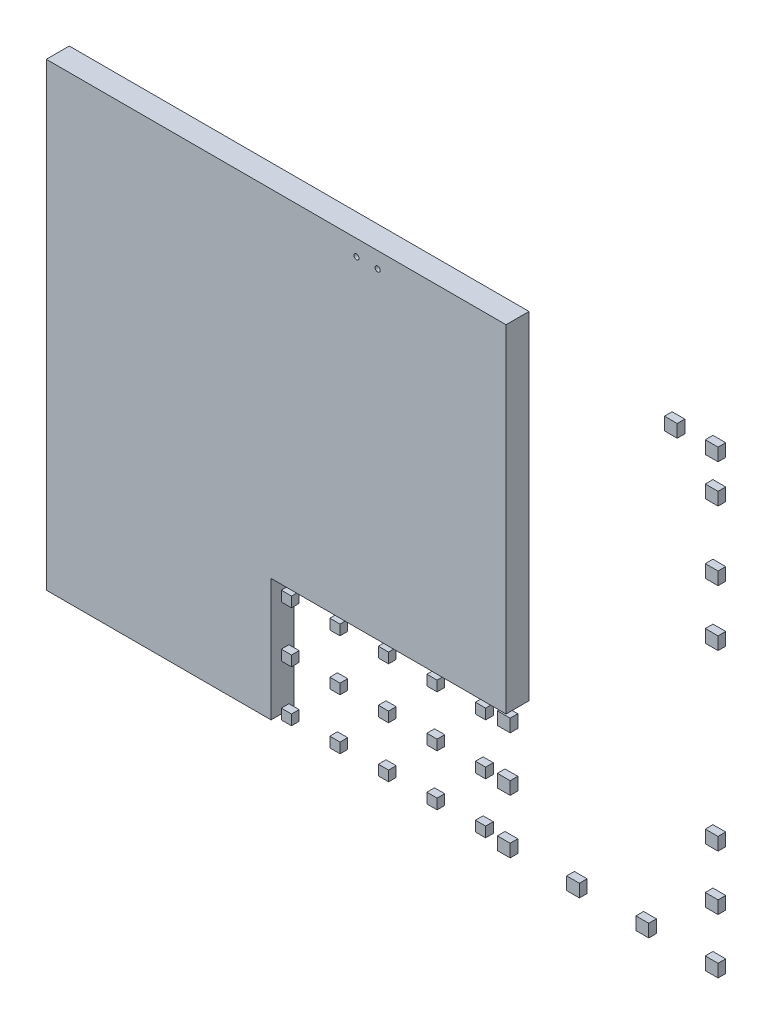
from build123d import *

# Parameters (mm, degrees)
SKETCH_1_R         = 50
EXTRUDE_1_DEPTH    = 150
SKETCH_1_W         = 250
SKETCH_1_H         = 250
EXTRUDE_1_2_DEPTH  = 150
EXTRUDE_1_3_DEPTH  = 150
EXTRUDE_1_4_DEPTH  = 150
EXTRUDE_1_5_DEPTH  = 150
EXTRUDE_1_6_DEPTH  = 150
EXTRUDE_1_7_DEPTH  = 150
EXTRUDE_1_8_DEPTH  = 150
EXTRUDE_1_9_DEPTH  = 150
EXTRUDE_1_10_DEPTH = 150
EXTRUDE_1_11_DEPTH = 150
EXTRUDE_1_12_DEPTH = 150
EXTRUDE_1_13_DEPTH = 150
EXTRUDE_1_14_DEPTH = 150
SKETCH_1_W_2       = 200
SKETCH_1_H_2       = 200
EXTRUDE_1_15_DEPTH = 150
EXTRUDE_1_16_DEPTH = 150
EXTRUDE_1_17_DEPTH = 150
EXTRUDE_1_18_DEPTH = 150
EXTRUDE_1_19_DEPTH = 150
EXTRUDE_1_20_DEPTH = 150
EXTRUDE_1_21_DEPTH = 150
EXTRUDE_1_22_DEPTH = 150
EXTRUDE_1_23_DEPTH = 150
EXTRUDE_1_24_DEPTH = 150
EXTRUDE_1_25_DEPTH = 150
EXTRUDE_1_26_DEPTH = 150
EXTRUDE_1_27_DEPTH = 150
EXTRUDE_1_28_DEPTH = 150
EXTRUDE_1_29_DEPTH = 150
EXTRUDE_2_DEPTH    = 300


with BuildPart() as part:
    # Эскиз1 → Бобышка-Вытянуть1 (new body)
    with BuildSketch(Plane.XY):
        Polygon((0, 0), (9000, 0), (9000, -6600), (4400, -6600), (4400, -9000), (0, -9000), align=None)
        with Locations((6486.244831881, -312.492160742)):
            Circle(SKETCH_1_R, mode=Mode.SUBTRACT)
        with Locations((6070.943926101, -312.492160742)):
            Circle(SKETCH_1_R, mode=Mode.SUBTRACT)
    extrude(amount=-EXTRUDE_1_DEPTH)

    # Эскиз2 → Бобышка-Вытянуть2 (add)
    with BuildSketch(Plane(origin=(0, 0, -150), x_dir=(-1, 0, 0), z_dir=(0, 0, -1))):
        Polygon((0, -9000), (0, 0), (-9000, 0), (-9000, -6600), (-4400, -6600), (-4400, -9000), align=None)
        Polygon((-450, -8550), (-450, -450), (-8550, -450), (-8550, -6150), (-3950, -6150), (-3950, -8550), align=None, mode=Mode.SUBTRACT)
    extrude(amount=EXTRUDE_2_DEPTH)


with BuildPart() as body_2:
    # Эскиз1 → Extrude 1 2 (new body)
    with BuildSketch(Plane.XY):
        with Locations((8955, -8875)):
            Rectangle(SKETCH_1_W, SKETCH_1_H)
    extrude(amount=-EXTRUDE_1_2_DEPTH)


with BuildPart() as body_3:
    # Эскиз1 → Extrude 1 3 (new body)
    with BuildSketch(Plane.XY):
        with Locations((8955, -6755)):
            Rectangle(SKETCH_1_W, SKETCH_1_H)
    extrude(amount=-EXTRUDE_1_3_DEPTH)


with BuildPart() as body_4:
    # Эскиз1 → Extrude 1 4 (new body)
    with BuildSketch(Plane.XY):
        with Locations((8955, -7815)):
            Rectangle(SKETCH_1_W, SKETCH_1_H)
    extrude(amount=-EXTRUDE_1_4_DEPTH)


with BuildPart() as body_5:
    # Эскиз1 → Extrude 1 5 (new body)
    with BuildSketch(Plane.XY):
        with Locations((10311.666666667, -8875)):
            Rectangle(SKETCH_1_W, SKETCH_1_H)
    extrude(amount=-EXTRUDE_1_5_DEPTH)


with BuildPart() as body_6:
    # Эскиз1 → Extrude 1 6 (new body)
    with BuildSketch(Plane.XY):
        with Locations((11668.333333333, -8875)):
            Rectangle(SKETCH_1_W, SKETCH_1_H)
    extrude(amount=-EXTRUDE_1_6_DEPTH)


with BuildPart() as body_7:
    # Эскиз1 → Extrude 1 7 (new body)
    with BuildSketch(Plane.XY):
        with Locations((13025, -8875)):
            Rectangle(SKETCH_1_W, SKETCH_1_H)
    extrude(amount=-EXTRUDE_1_7_DEPTH)


with BuildPart() as body_8:
    # Эскиз1 → Extrude 1 8 (new body)
    with BuildSketch(Plane.XY):
        with Locations((13025, -6725)):
            Rectangle(SKETCH_1_W, SKETCH_1_H)
    extrude(amount=-EXTRUDE_1_8_DEPTH)


with BuildPart() as body_9:
    # Эскиз1 → Extrude 1 9 (new body)
    with BuildSketch(Plane.XY):
        with Locations((13025, -7800)):
            Rectangle(SKETCH_1_W, SKETCH_1_H)
    extrude(amount=-EXTRUDE_1_9_DEPTH)


with BuildPart() as body_10:
    # Эскиз1 → Extrude 1 10 (new body)
    with BuildSketch(Plane.XY):
        with Locations((13025, -3325)):
            Rectangle(SKETCH_1_W, SKETCH_1_H)
    extrude(amount=-EXTRUDE_1_10_DEPTH)


with BuildPart() as body_11:
    # Эскиз1 → Extrude 1 11 (new body)
    with BuildSketch(Plane.XY):
        with Locations((13025, -2225)):
            Rectangle(SKETCH_1_W, SKETCH_1_H)
    extrude(amount=-EXTRUDE_1_11_DEPTH)


with BuildPart() as body_12:
    # Эскиз1 → Extrude 1 12 (new body)
    with BuildSketch(Plane.XY):
        with Locations((13025, -875)):
            Rectangle(SKETCH_1_W, SKETCH_1_H)
    extrude(amount=-EXTRUDE_1_12_DEPTH)


with BuildPart() as body_13:
    # Эскиз1 → Extrude 1 13 (new body)
    with BuildSketch(Plane.XY):
        with Locations((13025, -125)):
            Rectangle(SKETCH_1_W, SKETCH_1_H)
    extrude(amount=-EXTRUDE_1_13_DEPTH)


with BuildPart() as body_14:
    # Эскиз1 → Extrude 1 14 (new body)
    with BuildSketch(Plane.XY):
        with Locations((12225, -125)):
            Rectangle(SKETCH_1_W, SKETCH_1_H)
    extrude(amount=-EXTRUDE_1_14_DEPTH)


with BuildPart() as body_15:
    # Эскиз1 → Extrude 1 15 (new body)
    with BuildSketch(Plane.XY):
        with Locations((4700, -6800)):
            Rectangle(SKETCH_1_W_2, SKETCH_1_H_2)
    extrude(amount=-EXTRUDE_1_15_DEPTH)


with BuildPart() as body_16:
    # Эскиз1 → Extrude 1 16 (new body)
    with BuildSketch(Plane.XY):
        with Locations((4700, -7800)):
            Rectangle(SKETCH_1_W_2, SKETCH_1_H_2)
    extrude(amount=-EXTRUDE_1_16_DEPTH)


with BuildPart() as body_17:
    # Эскиз1 → Extrude 1 17 (new body)
    with BuildSketch(Plane.XY):
        with Locations((4700, -8800)):
            Rectangle(SKETCH_1_W_2, SKETCH_1_H_2)
    extrude(amount=-EXTRUDE_1_17_DEPTH)


with BuildPart() as body_18:
    # Эскиз1 → Extrude 1 18 (new body)
    with BuildSketch(Plane.XY):
        with Locations((5650, -6800)):
            Rectangle(SKETCH_1_W_2, SKETCH_1_H_2)
    extrude(amount=-EXTRUDE_1_18_DEPTH)


with BuildPart() as body_19:
    # Эскиз1 → Extrude 1 19 (new body)
    with BuildSketch(Plane.XY):
        with Locations((5650, -7800)):
            Rectangle(SKETCH_1_W_2, SKETCH_1_H_2)
    extrude(amount=-EXTRUDE_1_19_DEPTH)


with BuildPart() as body_20:
    # Эскиз1 → Extrude 1 20 (new body)
    with BuildSketch(Plane.XY):
        with Locations((5650, -8800)):
            Rectangle(SKETCH_1_W_2, SKETCH_1_H_2)
    extrude(amount=-EXTRUDE_1_20_DEPTH)


with BuildPart() as body_21:
    # Эскиз1 → Extrude 1 21 (new body)
    with BuildSketch(Plane.XY):
        with Locations((6600, -6800)):
            Rectangle(SKETCH_1_W_2, SKETCH_1_H_2)
    extrude(amount=-EXTRUDE_1_21_DEPTH)


with BuildPart() as body_22:
    # Эскиз1 → Extrude 1 22 (new body)
    with BuildSketch(Plane.XY):
        with Locations((6600, -7800)):
            Rectangle(SKETCH_1_W_2, SKETCH_1_H_2)
    extrude(amount=-EXTRUDE_1_22_DEPTH)


with BuildPart() as body_23:
    # Эскиз1 → Extrude 1 23 (new body)
    with BuildSketch(Plane.XY):
        with Locations((6600, -8800)):
            Rectangle(SKETCH_1_W_2, SKETCH_1_H_2)
    extrude(amount=-EXTRUDE_1_23_DEPTH)


with BuildPart() as body_24:
    # Эскиз1 → Extrude 1 24 (new body)
    with BuildSketch(Plane.XY):
        with Locations((7550, -6800)):
            Rectangle(SKETCH_1_W_2, SKETCH_1_H_2)
    extrude(amount=-EXTRUDE_1_24_DEPTH)


with BuildPart() as body_25:
    # Эскиз1 → Extrude 1 25 (new body)
    with BuildSketch(Plane.XY):
        with Locations((7550, -7800)):
            Rectangle(SKETCH_1_W_2, SKETCH_1_H_2)
    extrude(amount=-EXTRUDE_1_25_DEPTH)


with BuildPart() as body_26:
    # Эскиз1 → Extrude 1 26 (new body)
    with BuildSketch(Plane.XY):
        with Locations((7550, -8800)):
            Rectangle(SKETCH_1_W_2, SKETCH_1_H_2)
    extrude(amount=-EXTRUDE_1_26_DEPTH)


with BuildPart() as body_27:
    # Эскиз1 → Extrude 1 27 (new body)
    with BuildSketch(Plane.XY):
        with Locations((8500, -6800)):
            Rectangle(SKETCH_1_W_2, SKETCH_1_H_2)
    extrude(amount=-EXTRUDE_1_27_DEPTH)


with BuildPart() as body_28:
    # Эскиз1 → Extrude 1 28 (new body)
    with BuildSketch(Plane.XY):
        with Locations((8500, -7800)):
            Rectangle(SKETCH_1_W_2, SKETCH_1_H_2)
    extrude(amount=-EXTRUDE_1_28_DEPTH)


with BuildPart() as body_29:
    # Эскиз1 → Extrude 1 29 (new body)
    with BuildSketch(Plane.XY):
        with Locations((8500, -8800)):
            Rectangle(SKETCH_1_W_2, SKETCH_1_H_2)
    extrude(amount=-EXTRUDE_1_29_DEPTH)


solid = Compound([part.part, body_2.part, body_3.part, body_4.part, body_5.part, body_6.part, body_7.part, body_8.part, body_9.part, body_10.part, body_11.part, body_12.part, body_13.part, body_14.part, body_15.part, body_16.part, body_17.part, body_18.part, body_19.part, body_20.part, body_21.part, body_22.part, body_23.part, body_24.part, body_25.part, body_26.part, body_27.part, body_28.part, body_29.part])
